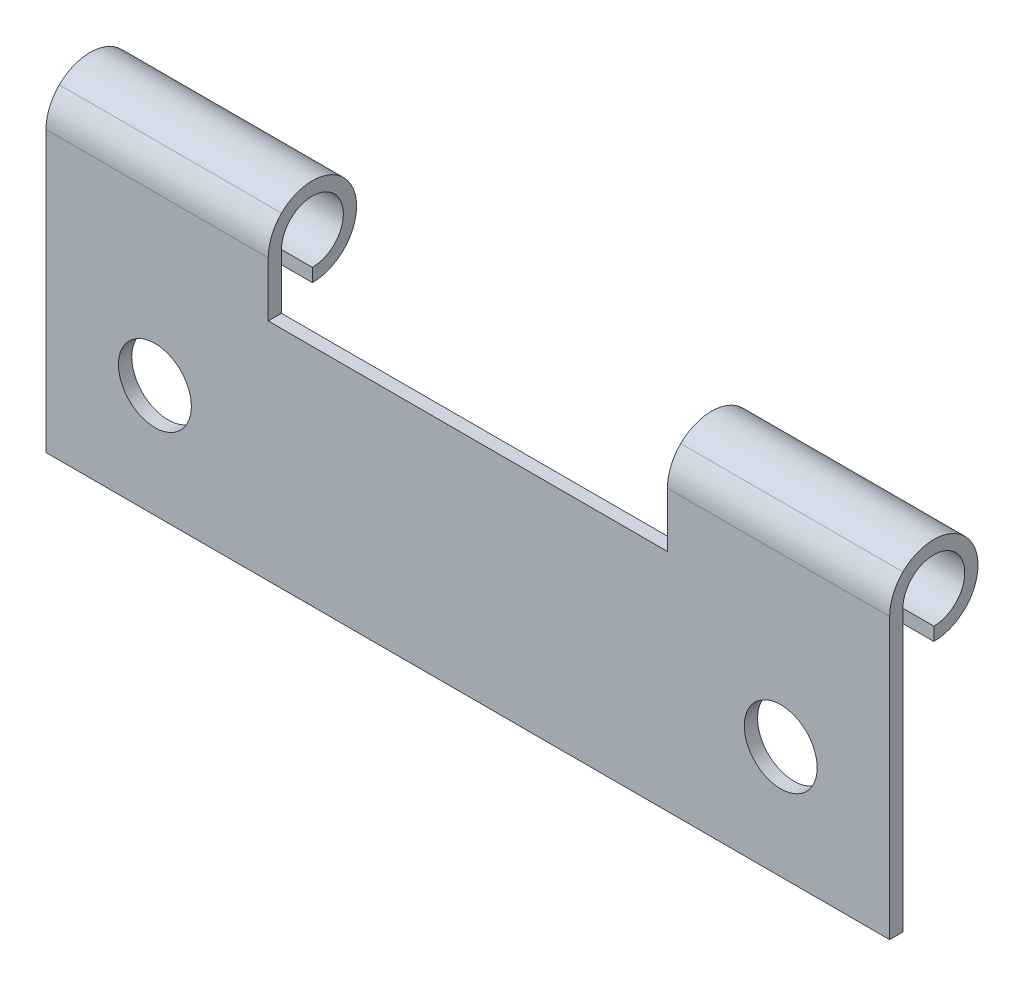
from build123d import *

# Parameters (mm, degrees)
SKETCH1_W           = 38.19
SKETCH1_H           = 10.19
BOSS_EXTRUDE1_DEPTH = 0.6
SKETCH2_W           = 10.06
SKETCH2_H           = 0.6
BOSS_EXTRUDE2_DEPTH = 4.5
BOSS_EXTRUDE3_DEPTH = 10.06
BOSS_EXTRUDE4_START = -10.06
BOSS_EXTRUDE4_DEPTH = 10.06
CUT_EXTRUDE1_DEPTH  = 40.672058177
SKETCH7_R           = 1.65
CUT_EXTRUDE2_DEPTH  = 10.01


with BuildPart() as part:
    # Sketch1 → Boss-Extrude1 (new body)
    with BuildSketch(Plane.XY):
        with Locations((19.095, -5.095)):
            Rectangle(SKETCH1_W, SKETCH1_H)
    extrude(amount=BOSS_EXTRUDE1_DEPTH)

    # Sketch2 → Boss-Extrude2 (add)
    with BuildSketch(Plane(origin=(0, 0, 0), x_dir=(1, 0, 0), z_dir=(0, 1, 0))):
        with Locations((5.03, -0.3)):
            Rectangle(SKETCH2_W, SKETCH2_H)
        with Locations((33.16, -0.3)):
            Rectangle(SKETCH2_W, SKETCH2_H)
    extrude(amount=BOSS_EXTRUDE2_DEPTH)

    # Sketch4 → Boss-Extrude3 (add)
    with BuildSketch(Plane(origin=(38.19, 0, 0), x_dir=(0, 0, -1), z_dir=(1, 0, 0))):
        with BuildLine():
            Line((0, 2.5), (-0.6, 2.5))
            ThreePointArc((-0.6, 2.5), (2.814213562, 3.914213562), (1.4, 0.5))
            Line((1.4, 0.5), (1.4, 1.1))
            ThreePointArc((1.4, 1.1), (2.389949494, 3.489949494), (0, 2.5))
        make_face()
    extrude(amount=-BOSS_EXTRUDE3_DEPTH)

    # Sketch5 → Boss-Extrude4 (add)
    with BuildSketch(Plane.ZY.offset(BOSS_EXTRUDE4_START)):
        with BuildLine():
            ThreePointArc((-1.4, 1.1), (-2.389949494, 3.489949494), (0, 2.5))
            Line((0, 2.5), (0, 3.928285686))
            ThreePointArc((0, 3.928285686), (-3.251563039, 3.256117924), (-1.4, 0.5))
            Line((-1.4, 0.5), (-1.4, 1.1))
        make_face()
        with BuildLine():
            Line((0, 3.928285686), (0, 2.5))
            Line((0, 2.5), (0.6, 2.5))
            ThreePointArc((0.6, 2.5), (0.443908891, 3.274596669), (0, 3.928285686))
        make_face()
    extrude(amount=BOSS_EXTRUDE4_DEPTH)

    # Sketch6 → Cut-Extrude1 (cut, through all)
    with BuildSketch(Plane.ZY):
        with BuildLine():
            Line((0, 3.928285686), (0, 4.5))
            Line((0, 4.5), (0.6, 4.5))
            Line((0.6, 4.5), (0.6, 2.47666439))
            ThreePointArc((0.6, 2.47666439), (0.44408843, 3.262031245), (0, 3.928285686))
        make_face()
    extrude(amount=-CUT_EXTRUDE1_DEPTH, mode=Mode.SUBTRACT)

    # Sketch7 → Cut-Extrude2 (cut)
    with BuildSketch(Plane(origin=(0, 0, 0), x_dir=(-1, 0, 0), z_dir=(0, 0, -1))):
        with Locations((-33.26, -5.095)):
            Circle(SKETCH7_R)
        with Locations((-4.93, -5.095)):
            Circle(SKETCH7_R)
    extrude(amount=-CUT_EXTRUDE2_DEPTH, mode=Mode.SUBTRACT)


solid = part.part
